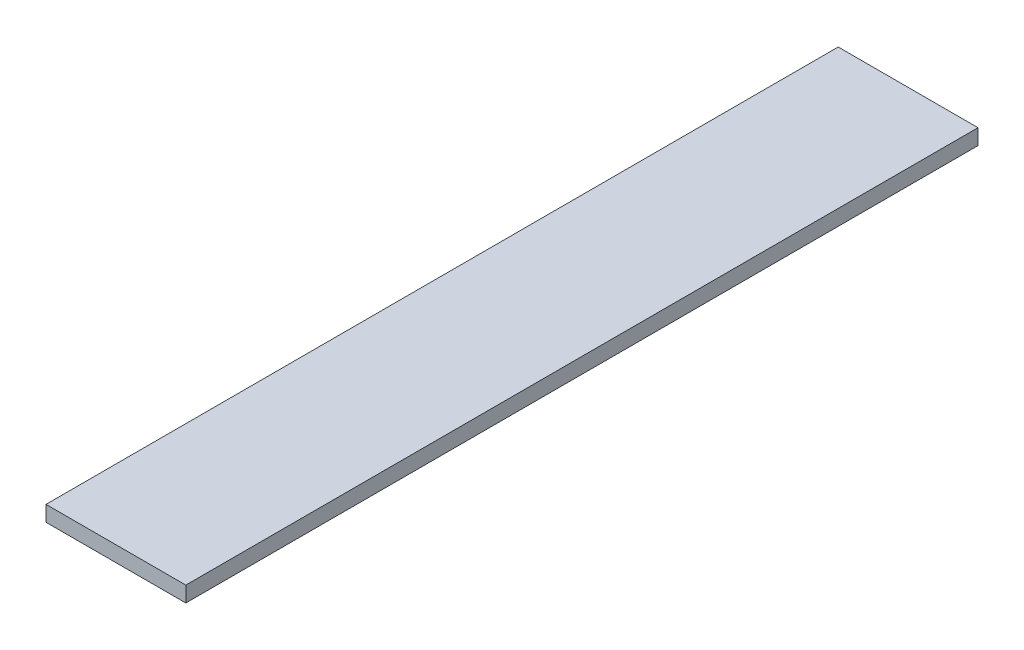
from build123d import *

# Parameters (mm, degrees)
SKETCH1_W           = 114.3
SKETCH1_H           = 647.7
BOSS_EXTRUDE1_DEPTH = 12.7


with BuildPart() as part:
    # Sketch1 → Boss-Extrude1 (new body)
    with BuildSketch(Plane(origin=(0, 0, 0), x_dir=(1, 0, 0), z_dir=(0, 1, 0))):
        Rectangle(SKETCH1_W, SKETCH1_H)
    extrude(amount=BOSS_EXTRUDE1_DEPTH)


solid = part.part
